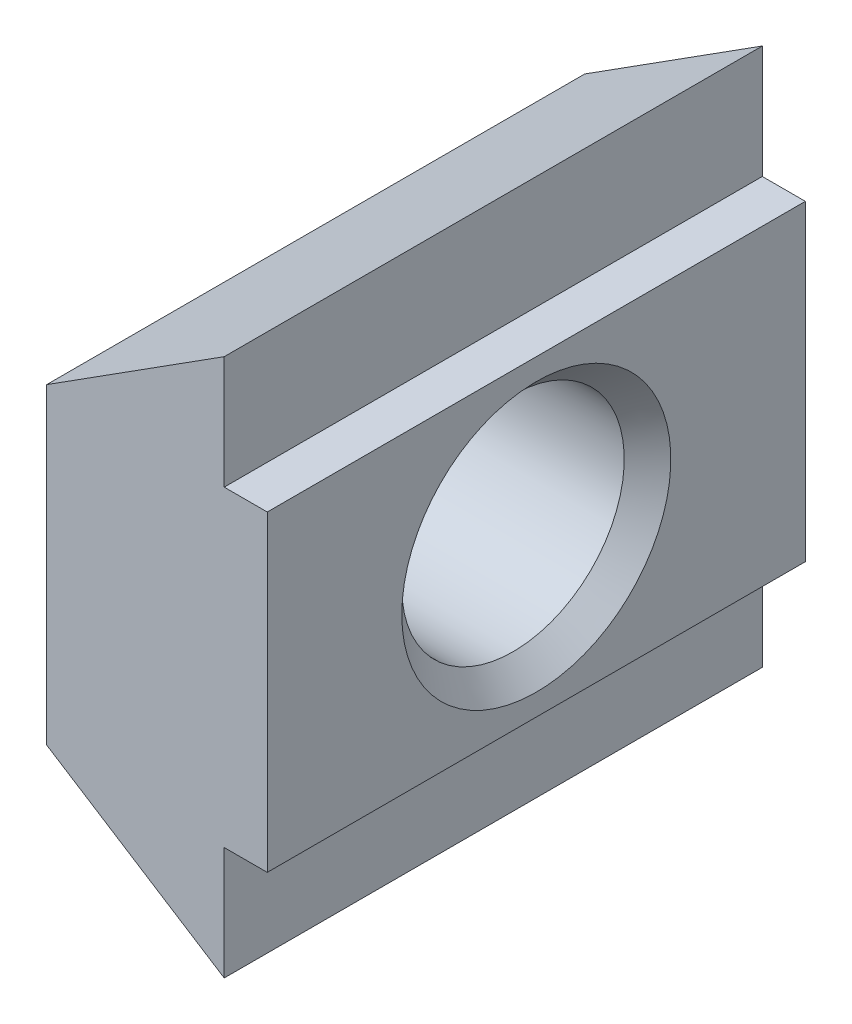
from build123d import *

# Parameters (mm, degrees)
EXTRUDE_1_DEPTH      = 5
EXTRUDE_1_DEPTH_BACK = 5


with BuildPart() as part:
    # 草圖1 → 填料-伸長1 (new, two sides: drawn at the far end of the back side and taken through both)
    with BuildSketch(Plane.XY.offset(-EXTRUDE_1_DEPTH_BACK)):
        Polygon((-4.1, 2.9), (-4.1, -2.9), (-0.8, -5), (-0.8, -2.9), (0, -2.9), (0, 2.9), (-0.8, 2.9), (-0.8, 5), align=None)
    extrude(amount=EXTRUDE_1_DEPTH + EXTRUDE_1_DEPTH_BACK)

    # 草圖2 → 除料-旋轉1 (revolve, cut)
    with BuildSketch(Plane.XY):
        Polygon((-4.1, 0), (-4.1, 2.5), (-3.667, 2.067), (-0.433, 2.067), (0, 2.5), (0, 0), align=None)
    revolve(axis=Axis((0, 0, 0), (-1, 0, 0)), mode=Mode.SUBTRACT)


solid = part.part
